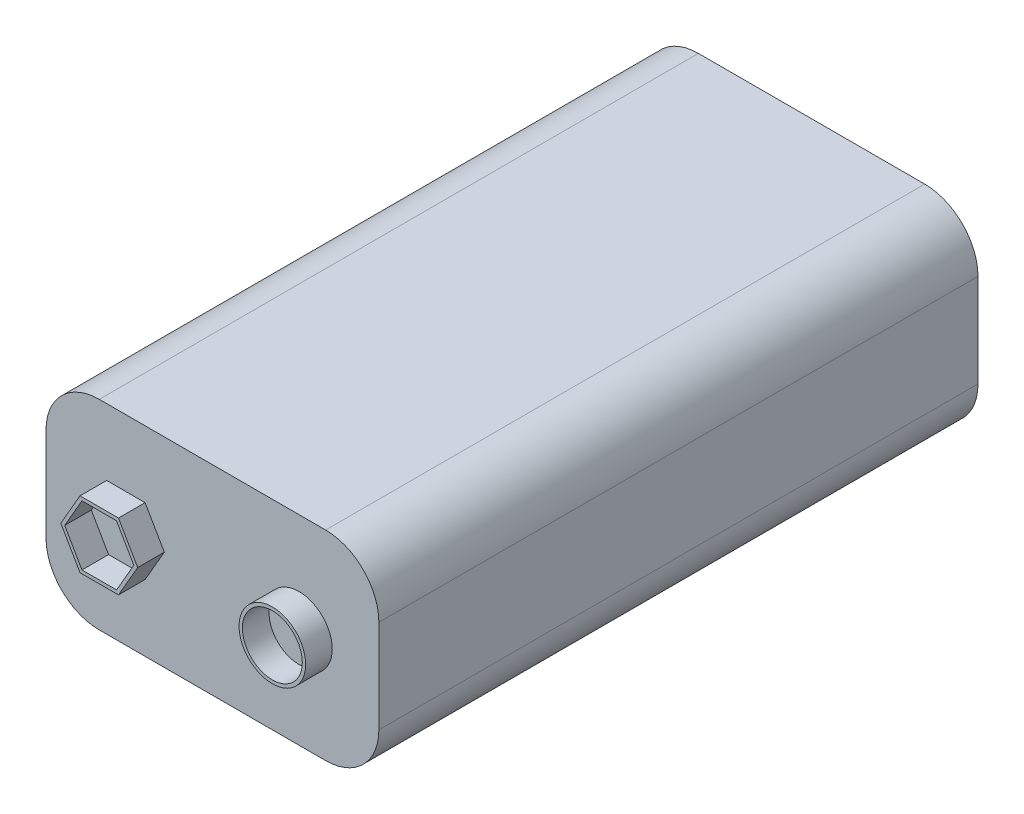
from build123d import *

# Parameters (mm, degrees)
BOSS_EXTRUDE1_DEPTH = 45
SKETCH2_R           = 2.5
SKETCH2_R_2         = 2.25
BOSS_EXTRUDE2_DEPTH = 2


with BuildPart() as part:
    # Sketch1 → Boss-Extrude1 (new body)
    with BuildSketch(Plane.XY):
        with BuildLine():
            Line((4, 0), (21, 0))
            ThreePointArc((21, 0), (23.828427125, 1.171572875), (25, 4))
            Line((25, 4), (25, 11))
            ThreePointArc((25, 11), (23.828427125, 13.828427125), (21, 15))
            Line((21, 15), (4, 15))
            ThreePointArc((4, 15), (1.171572875, 13.828427125), (0, 11))
            Line((0, 11), (0, 4))
            ThreePointArc((0, 4), (1.171572875, 1.171572875), (4, 0))
        make_face()
    extrude(amount=BOSS_EXTRUDE1_DEPTH)

    # Sketch2 → Boss-Extrude2 (add)
    # profile 1 of 2: a face of its own
    with BuildSketch(Plane.XY.offset(45)):
        with Locations((19, 7.5)):
            Circle(SKETCH2_R)
        with Locations((19, 7.5)):
            Circle(SKETCH2_R_2, mode=Mode.SUBTRACT)
    # profile 2 of 2: a face of its own
    with BuildSketch(Plane.XY.offset(45)):
        Polygon((8.886751346, 7.5), (7.443375673, 10), (4.556624327, 10), (3.113248654, 7.5), (4.556624327, 5), (7.443375673, 5), align=None)
        Polygon((8.598076211, 7.5), (7.299038106, 9.75), (4.700961894, 9.75), (3.401923789, 7.5), (4.700961894, 5.25), (7.299038106, 5.25), align=None, mode=Mode.SUBTRACT)
    extrude(amount=BOSS_EXTRUDE2_DEPTH)


solid = part.part
